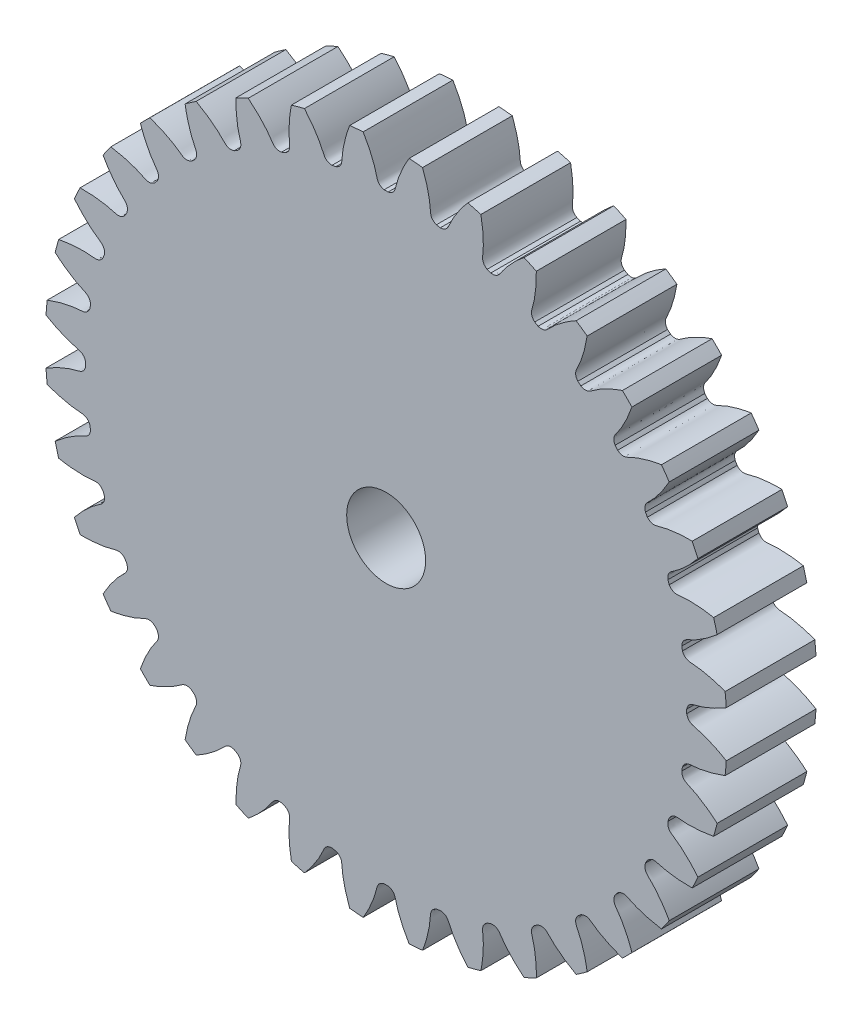
from build123d import *

# Parameters (mm, degrees)
SKETCH_1_R               = 9.5
EXTRUDE_1_DEPTH          = 2.5
CUT_EXTRUDE_1_DEPTH      = 14.665650369
PATTERN_CIRCULAR_1_COUNT = 36
CUT_EXTRUDE_2_REACH      = 15.636
SKETCH_4_R               = 1.1


with BuildPart() as part:
    # 草图1 → 凸台-拉伸1 (new body)
    with BuildSketch(Plane.XY):
        Circle(SKETCH_1_R)
    extrude(amount=EXTRUDE_1_DEPTH)

    # 草图2 → 切除-拉伸1 (cut, through all)
    with BuildSketch(Plane.XY):
        with BuildLine():
            ThreePointArc((0.054934474, 8.374819831), (0, 8.375), (-0.054934474, 8.374819831))
            add(Edge.make_bspline(
                [(-0.054934474, 8.374819831), (-0.234978953, 8.415201319), (-0.250497423, 8.549314662), (-0.288218357, 8.691373568), (-0.299748628, 8.731851177), (-0.31309989, 8.775314366), (-0.328367396, 8.821718829), (-0.34568221, 8.870999935), (-0.365162519, 8.923094297), (-0.386928046, 8.977933385), (-0.411095645, 9.035445483), (-0.437780475, 9.09555517), (-0.467095531, 9.15818354), (-0.499151661, 9.223248205), (-0.534057436, 9.290663368), (-0.571919068, 9.360339873), (-0.612840323, 9.432185269), (-0.656922424, 9.506103874), (-0.704263969, 9.581996838), (-0.754960844, 9.659762209), (-0.809106137, 9.739295006), (-0.866790057, 9.820487287), (-0.928099853, 9.903228226), (-0.993119734, 9.987404187), (-1.061930793, 10.072898798), (-1.134610932, 10.15959304), (-1.211234787, 10.247365317), (-1.291873657, 10.33609155), (-1.376595441, 10.425645255), (-1.46546454, 10.515897632), (-1.591181957, 10.63856609), (-1.689482035, 10.72881939), (-1.757006718, 10.78843362)],
                knots=[0, 0, 0, 0, 0.120371484, 0.133302531, 0.147363917, 0.16255564, 0.178877702, 0.196330101, 0.214912839, 0.234625915, 0.25546933, 0.277443082, 0.300547173, 0.324781601, 0.350146368, 0.376641473, 0.404266917, 0.433022698, 0.462908818, 0.493925275, 0.526072071, 0.559349205, 0.593756678, 0.629294488, 0.665962637, 0.703761124, 0.742689949, 0.782749112, 0.823938613, 0.866258453, 0.90970863, 1, 1, 1, 1], degree=3))
            ThreePointArc((-1.757006718, 10.78843362), (0, 10.930570551), (1.757006718, 10.78843362))
            add(Edge.make_bspline(
                [(0.054934474, 8.374819831), (0.234978953, 8.415201319), (0.250497423, 8.549314662), (0.288218357, 8.691373568), (0.299748628, 8.731851177), (0.31309989, 8.775314366), (0.328367396, 8.821718829), (0.34568221, 8.870999935), (0.365162519, 8.923094297), (0.386928046, 8.977933385), (0.411095645, 9.035445483), (0.437780475, 9.09555517), (0.467095531, 9.15818354), (0.499151661, 9.223248205), (0.534057436, 9.290663368), (0.571919068, 9.360339873), (0.612840323, 9.432185269), (0.656922424, 9.506103874), (0.704263969, 9.581996838), (0.754960844, 9.659762209), (0.809106137, 9.739295006), (0.866790057, 9.820487287), (0.928099853, 9.903228226), (0.993119734, 9.987404187), (1.061930793, 10.072898798), (1.134610932, 10.15959304), (1.211234787, 10.247365317), (1.291873657, 10.33609155), (1.376595441, 10.425645255), (1.46546454, 10.515897632), (1.591181957, 10.63856609), (1.689482035, 10.72881939), (1.757006718, 10.78843362)],
                knots=[0, 0, 0, 0, 0.120371484, 0.133302531, 0.147363917, 0.16255564, 0.178877702, 0.196330101, 0.214912839, 0.234625915, 0.25546933, 0.277443082, 0.300547173, 0.324781601, 0.350146368, 0.376641473, 0.404266917, 0.433022698, 0.462908818, 0.493925275, 0.526072071, 0.559349205, 0.593756678, 0.629294488, 0.665962637, 0.703761124, 0.742689949, 0.782749112, 0.823938613, 0.866258453, 0.90970863, 1, 1, 1, 1], degree=3))
        make_face()
    cut_extrude_1 = extrude(amount=CUT_EXTRUDE_1_DEPTH, mode=Mode.SUBTRACT)

    # 阵列(圆周)1: 切除-拉伸1 ×36 about axis
    pattern_circular_1_axis = Axis((0, 0, 2.5), (0, 0, -1))
    for i in range(1, PATTERN_CIRCULAR_1_COUNT):
        add(cut_extrude_1.rotate(pattern_circular_1_axis, i * 360 / PATTERN_CIRCULAR_1_COUNT), mode=Mode.SUBTRACT)

    # 草图4 → 切除-拉伸2 (cut, up to next)
    with BuildSketch(Plane(origin=(0, 0, 0), x_dir=(-1, 0, 0), z_dir=(0, 0, -1)), mode=Mode.PRIVATE) as cut_extrude_2_sk1:
        Circle(SKETCH_4_R)
    cut_extrude_2_tool1 = extrude(cut_extrude_2_sk1.sketch, amount=-CUT_EXTRUDE_2_REACH, mode=Mode.PRIVATE) & part.part
    add(cut_extrude_2_tool1.solids().sort_by_distance((0, 0, 0))[0], mode=Mode.SUBTRACT)


solid = part.part
